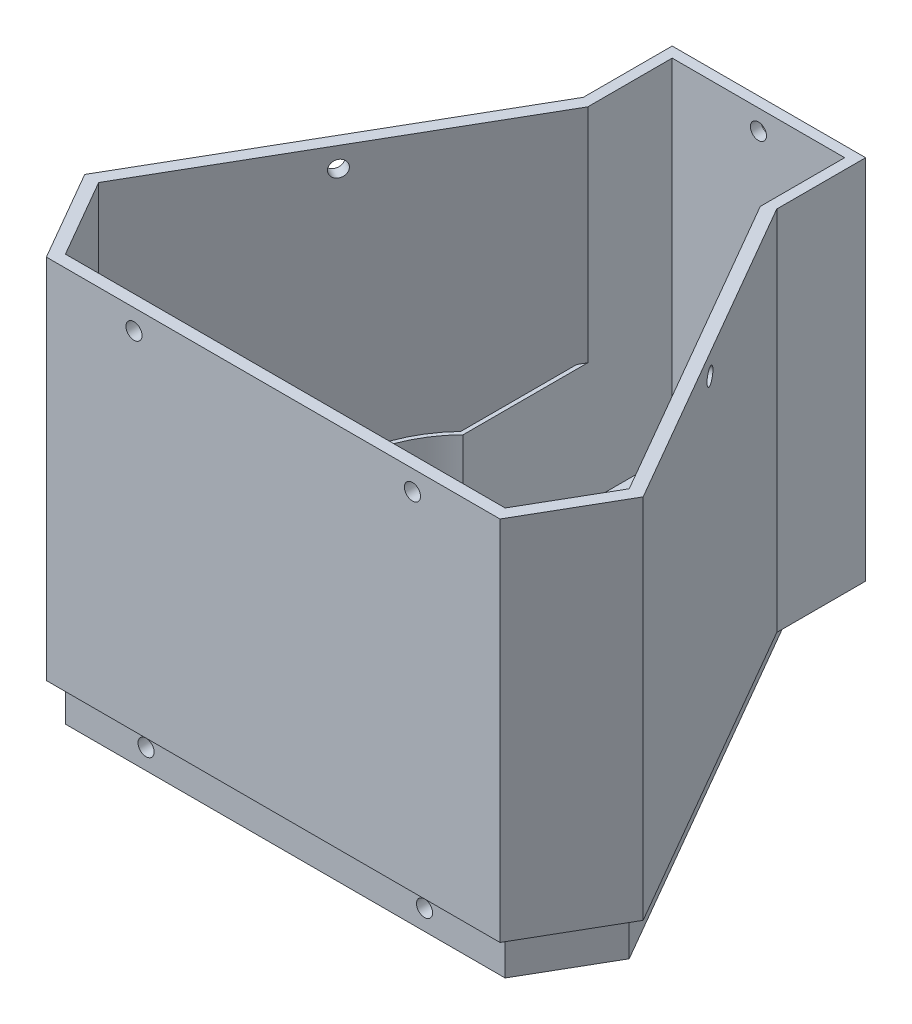
from build123d import *

# Parameters (mm, degrees)
SKETCH1_R           = 6
BOSS_EXTRUDE1_DEPTH = 10
BOSS_EXTRUDE2_START = 10
SKETCH1_3_R         = 6
BOSS_EXTRUDE2_DEPTH = 6
BOSS_EXTRUDE3_START = 16
BOSS_EXTRUDE3_DEPTH = 85
SKETCH3_R           = 2
CUT_EXTRUDE1_DEPTH  = 3
CUT_EXTRUDE7_START  = -3
SKETCH3_8_R         = 2
SKETCH3_8_R_2       = 3
CUT_EXTRUDE7_DEPTH  = 6
CUT_EXTRUDE8_START  = -3
SKETCH3_11_R        = 3
SKETCH3_11_R_2      = 2
CUT_EXTRUDE8_DEPTH  = 16
CIRPATTERN1_COUNT   = 3
SKETCH4_R           = 2
CUT_EXTRUDE9_DEPTH  = 16
BOSS_EXTRUDE4_DEPTH = 30
SKETCH6_R           = 2
CUT_EXTRUDE10_DEPTH = 30
SKETCH8_R           = 2
CUT_EXTRUDE11_DEPTH = 30
CUT_EXTRUDE12_START = 13
SKETCH1_5_R         = 9.6
SKETCH1_5_R_2       = 8.6
SKETCH1_5_R_3       = 6
CUT_EXTRUDE12_DEPTH = 3
CUT_EXTRUDE13_START = 9
SKETCH1_6_R         = 8.6
SKETCH1_6_R_2       = 6
CUT_EXTRUDE13_DEPTH = 7


with BuildPart() as part:
    # Sketch1 → Boss-Extrude1 (new body)
    with BuildSketch(Plane(origin=(0, 0, 0), x_dir=(1, 0, 0), z_dir=(0, 1, 0))):
        Polygon((-11.267949192, 69.494446501), (-65.817930688, -24.988893001), (-54.549981495, -44.505553499), (54.549981495, -44.505553499), (65.817930688, -24.988893001), (11.267949192, 69.494446501), align=None)
        with Locations(Location((0, 0, 0), (0, 0, 270))):
            Circle(SKETCH1_R, mode=Mode.SUBTRACT)
    extrude(amount=BOSS_EXTRUDE1_DEPTH)

    # Sketch1<3> → Boss-Extrude2 (add)
    with BuildSketch(Plane(origin=(0, 0, 0), x_dir=(1, 0, 0), z_dir=(0, 1, 0)).offset(BOSS_EXTRUDE2_START)):
        Polygon((24, 75.494446501), (-24, 75.494446501), (-24, 53.441887617), (-69.282032303, -24.988893001), (-56.282032303, -47.505553499), (56.282032303, -47.505553499), (69.282032303, -24.988893001), (24, 53.441887617), align=None)
        with Locations(Location((0, 0, 0), (0, 0, 270))):
            Circle(SKETCH1_3_R, mode=Mode.SUBTRACT)
    extrude(amount=BOSS_EXTRUDE2_DEPTH)

    # Sketch1<4> → Boss-Extrude3 (add)
    with BuildSketch(Plane(origin=(0, 0, 0), x_dir=(1, 0, 0), z_dir=(0, 1, 0)).offset(BOSS_EXTRUDE3_START)):
        Polygon((24, 75.494446501), (-24, 75.494446501), (-24, 53.441887617), (-41.141016151, 23.75277675), (-69.282032303, -24.988893001), (-56.282032303, -47.505553499), (0, -47.505553499), (56.282032303, -47.505553499), (69.282032303, -24.988893001), (41.141016151, 23.75277675), (24, 53.441887617), align=None)
        Polygon((-21.4, 51.945219717), (-21.4, 57.945219717), (-21.4, 72.894446501), (21.4, 72.894446501), (21.4, 57.945219717), (21.4, 51.945219717), (38.54293994, 22.25277675), (65.817930688, -24.988893001), (54.549981495, -44.505553499), (0, -44.505553499), (-54.549981495, -44.505553499), (-65.817930688, -24.988893001), (-38.54293994, 22.25277675), align=None, mode=Mode.SUBTRACT)
    extrude(amount=BOSS_EXTRUDE3_DEPTH)

    # Sketch3 → Cut-Extrude1 (cut)
    with BuildSketch(Plane(origin=(38.54293994, 0, -22.25277675), x_dir=(-0.5000000000000011, 0, -0.866025403784438), z_dir=(0.8660254037844382, 0, -0.5000000000000011))):
        with Locations((-34.549981495, 5)):
            Circle(SKETCH3_R)
        with Locations((34.549981495, 5)):
            Circle(SKETCH3_R)
    cut_extrude1 = extrude(amount=-CUT_EXTRUDE1_DEPTH, mode=Mode.SUBTRACT)

    # Sketch3<8> → Cut-Extrude7 (cut)
    # profile 1 of 8: a face of its own
    with BuildSketch(Plane(origin=(38.54293994, 0, -22.25277675), x_dir=(-0.5000000000000011, 0, -0.866025403784438), z_dir=(0.8660254037844382, 0, -0.5000000000000011)).offset(CUT_EXTRUDE7_START)):
        Polygon((-32.413785499, 8.7), (-36.686177491, 8.7), (-38.822373487, 5), (-36.686177491, 1.3), (-32.413785499, 1.3), (-30.277589503, 5), align=None)
        with Locations((-34.549981495, 5)):
            Circle(SKETCH3_8_R, mode=Mode.SUBTRACT)
    # profile 2 of 8: a face of its own
    with BuildSketch(Plane(origin=(38.54293994, 0, -22.25277675), x_dir=(-0.5000000000000011, 0, -0.866025403784438), z_dir=(0.8660254037844382, 0, -0.5000000000000011)).offset(CUT_EXTRUDE7_START)):
        Polygon((-38.822373487, 0), (-30.277589503, 0), (-30.277589503, 5), (-32.413785499, 1.3), (-36.686177491, 1.3), (-38.822373487, 5), align=None)
    # profile 3 of 8: a face of its own
    with BuildSketch(Plane(origin=(38.54293994, 0, -22.25277675), x_dir=(-0.5000000000000011, 0, -0.866025403784438), z_dir=(0.8660254037844382, 0, -0.5000000000000011)).offset(CUT_EXTRUDE7_START)):
        Polygon((38.822373487, 5), (36.686177491, 1.3), (32.413785499, 1.3), (30.277589503, 5), (32.413785499, 8.7), (36.686177491, 8.7), align=None)
        with Locations((34.549981495, 5)):
            Circle(SKETCH3_8_R, mode=Mode.SUBTRACT)
    # profile 4 of 8: a face of its own
    with BuildSketch(Plane(origin=(38.54293994, 0, -22.25277675), x_dir=(-0.5000000000000011, 0, -0.866025403784438), z_dir=(0.8660254037844382, 0, -0.5000000000000011)).offset(CUT_EXTRUDE7_START)):
        Polygon((38.822373487, 0), (38.822373487, 5), (36.686177491, 1.3), (32.413785499, 1.3), (30.277589503, 5), (30.277589503, 0), align=None)
    # profile 5 of 8: a face of its own
    with BuildSketch(Plane(origin=(38.54293994, 0, -22.25277675), x_dir=(-0.5000000000000011, 0, -0.866025403784438), z_dir=(0.8660254037844382, 0, -0.5000000000000011)).offset(CUT_EXTRUDE7_START)):
        with Locations((-34.549981495, 5)):
            Circle(SKETCH3_8_R_2)
        with Locations((-34.549981495, 5)):
            Circle(SKETCH3_8_R, mode=Mode.SUBTRACT)
    # profile 6 of 8: a face of its own
    with BuildSketch(Plane(origin=(38.54293994, 0, -22.25277675), x_dir=(-0.5000000000000011, 0, -0.866025403784438), z_dir=(0.8660254037844382, 0, -0.5000000000000011)).offset(CUT_EXTRUDE7_START)):
        with Locations((-34.549981495, 5)):
            Circle(SKETCH3_8_R)
    # profile 7 of 8: a face of its own
    with BuildSketch(Plane(origin=(38.54293994, 0, -22.25277675), x_dir=(-0.5000000000000011, 0, -0.866025403784438), z_dir=(0.8660254037844382, 0, -0.5000000000000011)).offset(CUT_EXTRUDE7_START)):
        with Locations((34.549981495, 5)):
            Circle(SKETCH3_8_R_2)
        with Locations((34.549981495, 5)):
            Circle(SKETCH3_8_R, mode=Mode.SUBTRACT)
    # profile 8 of 8: a face of its own
    with BuildSketch(Plane(origin=(38.54293994, 0, -22.25277675), x_dir=(-0.5000000000000011, 0, -0.866025403784438), z_dir=(0.8660254037844382, 0, -0.5000000000000011)).offset(CUT_EXTRUDE7_START)):
        with Locations((34.549981495, 5)):
            Circle(SKETCH3_8_R)
    cut_extrude7 = extrude(amount=-CUT_EXTRUDE7_DEPTH, mode=Mode.SUBTRACT)

    # Sketch3<11> → Cut-Extrude8 (cut)
    # profile 1 of 4: a face of its own
    with BuildSketch(Plane(origin=(38.54293994, 0, -22.25277675), x_dir=(-0.5000000000000011, 0, -0.866025403784438), z_dir=(0.8660254037844382, 0, -0.5000000000000011)).offset(CUT_EXTRUDE8_START)):
        with Locations((-34.549981495, 5)):
            Circle(SKETCH3_11_R)
        with Locations((-34.549981495, 5)):
            Circle(SKETCH3_11_R_2, mode=Mode.SUBTRACT)
    # profile 2 of 4: a face of its own
    with BuildSketch(Plane(origin=(38.54293994, 0, -22.25277675), x_dir=(-0.5000000000000011, 0, -0.866025403784438), z_dir=(0.8660254037844382, 0, -0.5000000000000011)).offset(CUT_EXTRUDE8_START)):
        with Locations((34.549981495, 5)):
            Circle(SKETCH3_11_R)
        with Locations((34.549981495, 5)):
            Circle(SKETCH3_11_R_2, mode=Mode.SUBTRACT)
    # profile 3 of 4: a face of its own
    with BuildSketch(Plane(origin=(38.54293994, 0, -22.25277675), x_dir=(-0.5000000000000011, 0, -0.866025403784438), z_dir=(0.8660254037844382, 0, -0.5000000000000011)).offset(CUT_EXTRUDE8_START)):
        with Locations((-34.549981495, 5)):
            Circle(SKETCH3_11_R_2)
    # profile 4 of 4: a face of its own
    with BuildSketch(Plane(origin=(38.54293994, 0, -22.25277675), x_dir=(-0.5000000000000011, 0, -0.866025403784438), z_dir=(0.8660254037844382, 0, -0.5000000000000011)).offset(CUT_EXTRUDE8_START)):
        with Locations((34.549981495, 5)):
            Circle(SKETCH3_11_R_2)
    cut_extrude8 = extrude(amount=-CUT_EXTRUDE8_DEPTH, mode=Mode.SUBTRACT)

    # CirPattern1: Cut-Extrude1, Cut-Extrude7, Cut-Extrude8 ×3 about axis
    cirpattern1_axis = Axis((0, 0, 0), (0, 1, 0))
    add([cut_extrude1.rotate(cirpattern1_axis, i * 360 / CIRPATTERN1_COUNT) for i in range(1, CIRPATTERN1_COUNT)], mode=Mode.SUBTRACT)
    add([cut_extrude7.rotate(cirpattern1_axis, i * 360 / CIRPATTERN1_COUNT) for i in range(1, CIRPATTERN1_COUNT)], mode=Mode.SUBTRACT)
    add([cut_extrude8.rotate(cirpattern1_axis, i * 360 / CIRPATTERN1_COUNT) for i in range(1, CIRPATTERN1_COUNT)], mode=Mode.SUBTRACT)

    # Sketch4 → Cut-Extrude9 (cut)
    with BuildSketch(Plane.XY.offset(-72.894446501)):
        with Locations((0, 30)):
            Circle(SKETCH4_R)
        with Locations((0, 96)):
            Circle(SKETCH4_R)
    extrude(amount=-CUT_EXTRUDE9_DEPTH, mode=Mode.SUBTRACT)

    # Sketch5 → Boss-Extrude4 (add)
    with BuildSketch(Plane(origin=(0, 16, 0), x_dir=(1, 0, 0), z_dir=(0, 1, 0))):
        with BuildLine():
            Line((21.4, 51.945219717), (21.4, 21.024747323))
            ThreePointArc((21.4, 21.024747323), (0, -30), (-21.4, 21.024747323))
            Line((-21.4, 21.024747323), (-21.4, 51.945219717))
            Line((-21.4, 51.945219717), (-22.4, 50.213168909))
            Line((-22.4, 50.213168909), (-22.4, 21.429885674))
            ThreePointArc((-22.4, 21.429885674), (0, -31), (22.4, 21.429885674))
            Line((22.4, 21.429885674), (22.4, 50.213168909))
            Line((22.4, 50.213168909), (21.4, 51.945219717))
        make_face()
    extrude(amount=BOSS_EXTRUDE4_DEPTH)

    # Sketch6 → Cut-Extrude10 (cut)
    with BuildSketch(Plane(origin=(41.141016151, 0, -23.75277675), x_dir=(-0.5000000000000007, 0, -0.8660254037844382), z_dir=(0.8660254037844383, 0, -0.5000000000000008))):
        with Locations((-11, 96)):
            Circle(SKETCH6_R)
    cut_extrude10 = extrude(amount=-CUT_EXTRUDE10_DEPTH, mode=Mode.SUBTRACT)

    # Sketch8 → Cut-Extrude11 (cut)
    with BuildSketch(Plane(origin=(0, 0, 44.505553499), x_dir=(-1, 0, 0), z_dir=(0, 0, -1))):
        with Locations((-34.549981495, 96)):
            Circle(SKETCH8_R)
    cut_extrude11 = extrude(amount=-CUT_EXTRUDE11_DEPTH, mode=Mode.SUBTRACT)

    # Mirror1: Cut-Extrude10, Cut-Extrude11 across plane
    add(cut_extrude10.mirror(Plane(origin=(0, 0, 0), x_dir=(0, 0, 1), z_dir=(1, 0, 0))), mode=Mode.SUBTRACT)
    add(cut_extrude11.mirror(Plane(origin=(0, 0, 0), x_dir=(0, 0, 1), z_dir=(1, 0, 0))), mode=Mode.SUBTRACT)

    # Sketch1<5> → Cut-Extrude12 (cut)
    # profile 1 of 2: a face of its own
    with BuildSketch(Plane(origin=(0, 0, 0), x_dir=(1, 0, 0), z_dir=(0, 1, 0)).offset(CUT_EXTRUDE12_START)):
        with Locations(Location((0, 0, 0), (0, 0, 270))):
            Circle(SKETCH1_5_R)
        Circle(SKETCH1_5_R_2, mode=Mode.SUBTRACT)
    # profile 2 of 2: a face of its own
    with BuildSketch(Plane(origin=(0, 0, 0), x_dir=(1, 0, 0), z_dir=(0, 1, 0)).offset(CUT_EXTRUDE12_START)):
        Circle(SKETCH1_5_R_2)
        with Locations(Location((0, 0, 0), (0, 0, 270))):
            Circle(SKETCH1_5_R_3, mode=Mode.SUBTRACT)
    extrude(amount=CUT_EXTRUDE12_DEPTH, mode=Mode.SUBTRACT)

    # Sketch1<6> → Cut-Extrude13 (cut)
    with BuildSketch(Plane(origin=(0, 0, 0), x_dir=(1, 0, 0), z_dir=(0, 1, 0)).offset(CUT_EXTRUDE13_START)):
        with Locations(Location((0, 0, 0), (0, 0, 270))):
            Circle(SKETCH1_6_R)
        with Locations(Location((0, 0, 0), (0, 0, 270))):
            Circle(SKETCH1_6_R_2, mode=Mode.SUBTRACT)
    extrude(amount=CUT_EXTRUDE13_DEPTH, mode=Mode.SUBTRACT)


solid = part.part
